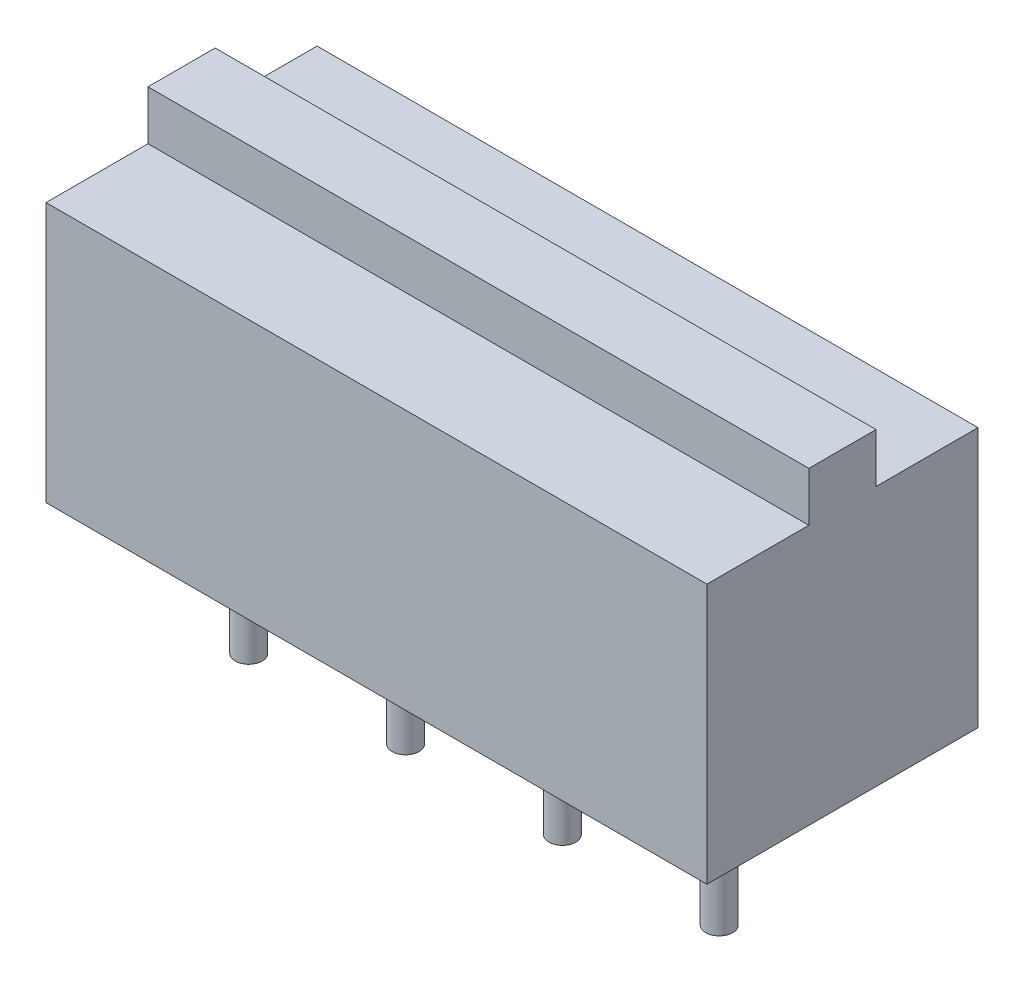
from build123d import *

# Parameters (mm, degrees)
CROQUIS1_W              = 29.5
CROQUIS1_H              = 12.1
SALIENTE_EXTRUIR1_DEPTH = 11.6
CROQUIS2_W              = 29.5
CROQUIS2_H              = 3
SALIENTE_EXTRUIR2_DEPTH = 2.2
CROQUIS3_R              = 0.6
SALIENTE_EXTRUIR3_DEPTH = 3.6


with BuildPart() as part:
    # Croquis1 → Saliente-Extruir1 (new body)
    with BuildSketch(Plane(origin=(0, 0, 0), x_dir=(1, 0, 0), z_dir=(0, 1, 0))):
        Rectangle(CROQUIS1_W, CROQUIS1_H)
    extrude(amount=SALIENTE_EXTRUIR1_DEPTH)

    # Croquis2 → Saliente-Extruir2 (add)
    with BuildSketch(Plane(origin=(0, 11.6, 0), x_dir=(1, 0, 0), z_dir=(0, 1, 0))):
        Rectangle(CROQUIS2_W, CROQUIS2_H)
    extrude(amount=SALIENTE_EXTRUIR2_DEPTH)

    # Croquis3 → Saliente-Extruir3 (add)
    with BuildSketch(Plane.XZ):
        with Locations(Location((-11.5, -1.35, 0), (0, 0, 270))):
            Circle(CROQUIS3_R)
        with Locations(Location((-8, 3.75, 0), (0, 0, 270))):
            Circle(CROQUIS3_R)
        with Locations(Location((-4.5, -1.35, 0), (0, 0, 270))):
            Circle(CROQUIS3_R)
        with Locations(Location((-1, 3.75, 0), (0, 0, 270))):
            Circle(CROQUIS3_R)
        with Locations(Location((2.5, -1.35, 0), (0, 0, 270))):
            Circle(CROQUIS3_R)
        with Locations(Location((6, 3.75, 0), (0, 0, 270))):
            Circle(CROQUIS3_R)
        with Locations(Location((9.5, -1.35, 0), (0, 0, 270))):
            Circle(CROQUIS3_R)
        with Locations(Location((13, 3.75, 0), (0, 0, 270))):
            Circle(CROQUIS3_R)
    extrude(amount=SALIENTE_EXTRUIR3_DEPTH)


solid = part.part
